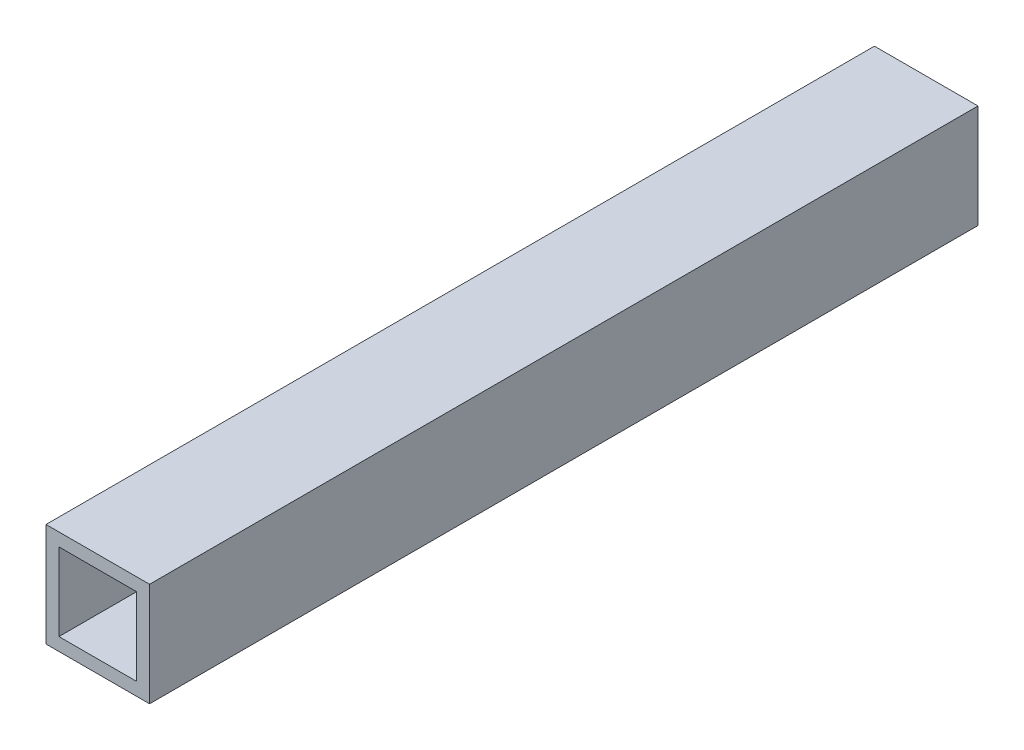
from build123d import *

# Parameters (mm, degrees)
SKETCH1_W           = 25.4
SKETCH1_H           = 25.4
SKETCH1_W_2         = 19.05
SKETCH1_H_2         = 19.05
BOSS_EXTRUDE1_DEPTH = 203.2


with BuildPart() as part:
    # Sketch1 → Boss-Extrude1 (new body)
    with BuildSketch(Plane.XY):
        Rectangle(SKETCH1_W, SKETCH1_H)
        Rectangle(SKETCH1_W_2, SKETCH1_H_2, mode=Mode.SUBTRACT)
    extrude(amount=BOSS_EXTRUDE1_DEPTH)


solid = part.part
